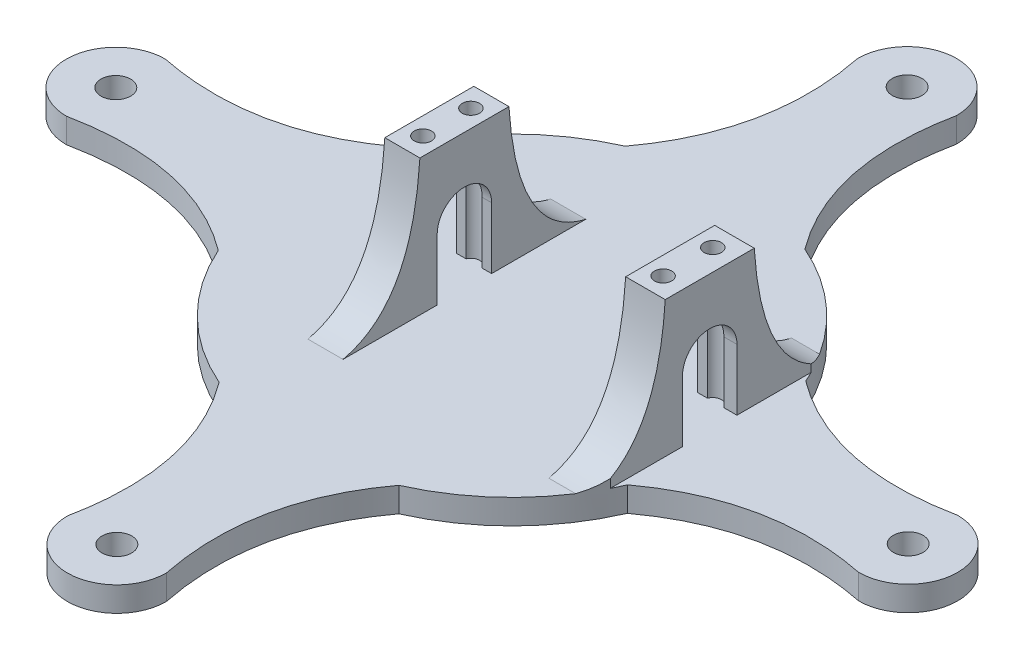
from build123d import *

# Parameters (mm, degrees)
SKIZZE1_R                            = 45
AUFSATZ_LINEAR_AUSTRAGEN1_DEPTH      = 5
SKIZZE3_W                            = 8
SKIZZE3_H                            = 18
AUFSATZ_LINEAR_AUSTRAGEN2_DEPTH      = 27.5
SCHNITT_LINEAR_AUSTRAGEN1_DEPTH      = 70.55
AUFSATZ_LINEAR_AUSTRAGEN3_DEPTH      = 56.7
SCHNITT_LINEAR_AUSTRAGEN2_DEPTH      = 10
SCHNITT_LINEAR_AUSTRAGEN3_DEPTH      = 78.313941464
SCHNITT_LINEAR_AUSTRAGEN3_DEPTH_BACK = 78.313941464
SKIZZE7_W                            = 40.7
SKIZZE7_H                            = 27.5
SCHNITT_LINEAR_START                 = -27.5
SKIZZE8_R                            = 1.75
SCHNITT_LINEAR_AUSTRAGEN4_DEPTH      = 27.5
AUFSATZ_LINEAR_AUSTRAGEN4_DEPTH      = 5
SCHNITT_LINEAR_AUSTRAGEN5_REACH      = 133.363
SKIZZE10_W                           = 0.902438157
SKIZZE10_H                           = 49.081982533
SKIZZE11_R                           = 3
SCHNITT_LINEAR_AUSTRAGEN6_DEPTH      = 14.11


with BuildPart() as part:
    # Skizze1 → Aufsatz-Linear austragen1 (new body)
    with BuildSketch(Plane(origin=(0, 0, 0), x_dir=(1, 0, 0), z_dir=(0, 1, 0))):
        with Locations(Location((0, 0, 0), (0, 0, 270))):
            Circle(SKIZZE1_R)
    extrude(amount=AUFSATZ_LINEAR_AUSTRAGEN1_DEPTH)

    # Skizze3 → Aufsatz-Linear austragen2 (add)
    with BuildSketch(Plane(origin=(0, 5, 0), x_dir=(1, 0, 0), z_dir=(0, 1, 0))):
        with Locations((-12.534256165, -0.183687062)):
            Rectangle(SKIZZE3_W, SKIZZE3_H)
        with Locations((36.165743835, -0.183687062)):
            Rectangle(SKIZZE3_W, SKIZZE3_H)
    extrude(amount=AUFSATZ_LINEAR_AUSTRAGEN2_DEPTH)

    # Skizze4 → Schnitt-Linear austragen1 (cut)
    with BuildSketch(Plane.ZY.offset(16.534256165)):
        with BuildLine():
            Line((-5.316312938, 5), (5.686817911, 5))
            Line((5.686817911, 5), (5.686817911, 17.409920336))
            ThreePointArc((5.686817911, 17.409920336), (0.185252486, 22.91148576), (-5.316312938, 17.409920336))
            Line((-5.316312938, 17.409920336), (-5.316312938, 5))
        make_face()
    extrude(amount=-SCHNITT_LINEAR_AUSTRAGEN1_DEPTH, mode=Mode.SUBTRACT)

    # Skizze5 → Aufsatz-Linear austragen3 (add)
    with BuildSketch(Plane.ZY.offset(16.534256165)):
        with BuildLine():
            Line((-8.816312938, 32.5), (-8.816312938, 5))
            Line((-8.816312938, 5), (-24.357304204, 5))
            add(Edge.make_bspline(
                [(-8.816312938, 32.5), (-10.372494309, 8.167321108), (-24.357304204, 5)],
                knots=[0, 0, 0, 1, 1, 1], degree=2))
        make_face()
        with BuildLine():
            Line((9.183687062, 32.5), (9.183687062, 5))
            Line((9.183687062, 5), (24.724678329, 5))
            add(Edge.make_bspline(
                [(9.183687062, 32.5), (10.739868433, 8.167321108), (24.724678329, 5)],
                knots=[0, 0, 0, 1, 1, 1], degree=2))
        make_face()
    extrude(amount=-AUFSATZ_LINEAR_AUSTRAGEN3_DEPTH)

    # Skizze6 → Schnitt-Linear austragen2 (cut)
    with BuildSketch(Plane.XZ):
        with BuildLine():
            Line((36.037718441, 26.949635426), (42.778201445, 28.630726097))
            Line((42.778201445, 28.630726097), (51.77679317, -24.277660434))
            Line((51.77679317, -24.277660434), (37.77898382, -29.776799822))
            Line((37.77898382, -29.776799822), (35.341876768, -27.855910441))
            ThreePointArc((35.341876768, -27.855910441), (44.996373382, -0.571298967), (36.037718441, 26.949635426))
        make_face()
    extrude(amount=-SCHNITT_LINEAR_AUSTRAGEN2_DEPTH, mode=Mode.SUBTRACT)

    # Skizze7 → Schnitt-Linear austragen3 (cut, two sides: drawn at the far end of the back side and taken through both)
    with BuildSketch(Plane.XY.offset(-8.816312938).offset(-SCHNITT_LINEAR_AUSTRAGEN3_DEPTH_BACK)):
        with Locations((11.815743835, 18.75)):
            Rectangle(SKIZZE7_W, SKIZZE7_H)
    extrude(amount=SCHNITT_LINEAR_AUSTRAGEN3_DEPTH + SCHNITT_LINEAR_AUSTRAGEN3_DEPTH_BACK, mode=Mode.SUBTRACT)

    # Skizze8 → Schnitt-Linear austragen4 (cut)
    with BuildSketch(Plane(origin=(0, 32.5, 0), x_dir=(1, 0, 0), z_dir=(0, 1, 0)).offset(SCHNITT_LINEAR_START)):
        with Locations(Location((-12.984256165, 4.666312938, 0), (0, 0, 270))):
            Circle(SKIZZE8_R)
        with Locations(Location((-12.984256165, -5.033687062, 0), (0, 0, 270))):
            Circle(SKIZZE8_R)
        with Locations(Location((35.81519379, -5.265385311, 0), (0, 0, 270))):
            Circle(SKIZZE8_R)
        with Locations(Location((35.862672939, 4.734501975, 0), (0, 0, 270))):
            Circle(SKIZZE8_R)
    extrude(amount=SCHNITT_LINEAR_AUSTRAGEN4_DEPTH, mode=Mode.SUBTRACT)

    # Skizze9 → Aufsatz-Linear austragen4 (add, through all)
    with BuildSketch(Plane(origin=(0, 5, 0), x_dir=(1, 0, 0), z_dir=(0, 1, 0))):
        with BuildLine():
            Line((-18.254939841, 41.130975814), (18.045289753, 41.130975814))
            add(Edge.make_bspline(
                [(9.895174956, 79.999931323), (5.449457034, 58.022999533), (18.045289753, 41.130975814)],
                knots=[0, 0, 0, 1, 1, 1], degree=2))
            ThreePointArc((9.895174956, 79.999931323), (-0.104825044, 89.999931323), (-10.104825044, 79.999931323))
            add(Edge.make_bspline(
                [(-10.104825044, 79.999931323), (-5.659107122, 58.022999533), (-18.254939841, 41.130975814)],
                knots=[0, 0, 0, 1, 1, 1], degree=2))
        make_face()
        with BuildLine():
            Line((41.130975814, 18.254939841), (41.130975814, -18.045289753))
            add(Edge.make_bspline(
                [(79.999931323, -9.895174956), (58.022999533, -5.449457034), (41.130975814, -18.045289753)],
                knots=[0, 0, 0, 1, 1, 1], degree=2))
            ThreePointArc((79.999931323, -9.895174956), (89.999931323, 0.104825044), (79.999931323, 10.104825044))
            add(Edge.make_bspline(
                [(79.999931323, 10.104825044), (58.022999533, 5.659107122), (41.130975814, 18.254939841)],
                knots=[0, 0, 0, 1, 1, 1], degree=2))
        make_face()
        with BuildLine():
            Line((-18.045289753, -41.130975814), (18.254939841, -41.130975814))
            add(Edge.make_bspline(
                [(10.104825044, -79.999931323), (5.659107122, -58.022999533), (18.254939841, -41.130975814)],
                knots=[0, 0, 0, 1, 1, 1], degree=2))
            ThreePointArc((10.104825044, -79.999931323), (0.104825044, -89.999931323), (-9.895174956, -79.999931323))
            add(Edge.make_bspline(
                [(-9.895174956, -79.999931323), (-5.449457034, -58.022999533), (-18.045289753, -41.130975814)],
                knots=[0, 0, 0, 1, 1, 1], degree=2))
        make_face()
        with BuildLine():
            Line((-41.130975814, 18.045289753), (-41.130975814, -18.254939841))
            add(Edge.make_bspline(
                [(-79.999931323, -10.104825044), (-58.022999533, -5.659107122), (-41.130975814, -18.254939841)],
                knots=[0, 0, 0, 1, 1, 1], degree=2))
            ThreePointArc((-79.999931323, -10.104825044), (-89.999931323, -0.104825044), (-79.999931323, 9.895174956))
            add(Edge.make_bspline(
                [(-79.999931323, 9.895174956), (-58.022999533, 5.449457034), (-41.130975814, 18.045289753)],
                knots=[0, 0, 0, 1, 1, 1], degree=2))
        make_face()
    extrude(amount=-AUFSATZ_LINEAR_AUSTRAGEN4_DEPTH)

    # Schnitt-Linear austragen5: up to this face of the body (flat: up to its plane)
    schnitt_linear_austragen5_end = Plane(part.part.faces().sort_by_distance((-0.703165137, 5, -0.008888692))[0])
    # Skizze10 → Schnitt-Linear austragen5 (cut, up to the picked face)
    with BuildSketch(Plane(origin=(0, 32.5, 0), x_dir=(1, 0, 0), z_dir=(0, 1, 0)), mode=Mode.PRIVATE) as schnitt_linear_austragen5_sk1:
        with Locations((-8.985475244, -0.183687063)):
            Rectangle(SKIZZE10_W, SKIZZE10_H)
    schnitt_linear_austragen5_tool1 = split(extrude(schnitt_linear_austragen5_sk1.sketch, amount=-SCHNITT_LINEAR_AUSTRAGEN5_REACH, mode=Mode.PRIVATE), bisect_by=schnitt_linear_austragen5_end, keep=Keep.BOTH, mode=Mode.PRIVATE)
    add(schnitt_linear_austragen5_tool1.solids().sort_by(Axis((-8.985475, 32.5, 0.183687), (0, -1, 0)))[0], mode=Mode.SUBTRACT)

    # Skizze11 → Schnitt-Linear austragen6 (cut)
    with BuildSketch(Plane(origin=(0, 5, 0), x_dir=(1, 0, 0), z_dir=(0, 1, 0))):
        with Locations(Location((-79.999931323, -0.104825044, 0), (0, 0, 270))):
            Circle(SKIZZE11_R)
        with Locations(Location((-0.104825044, 79.999931323, 0), (0, 0, 270))):
            Circle(SKIZZE11_R)
        with Locations(Location((79.999931323, 0.104825044, 0), (0, 0, 270))):
            Circle(SKIZZE11_R)
        with Locations(Location((0.104825044, -79.999931323, 0), (0, 0, 270))):
            Circle(SKIZZE11_R)
    extrude(amount=-SCHNITT_LINEAR_AUSTRAGEN6_DEPTH, mode=Mode.SUBTRACT)


solid = part.part
